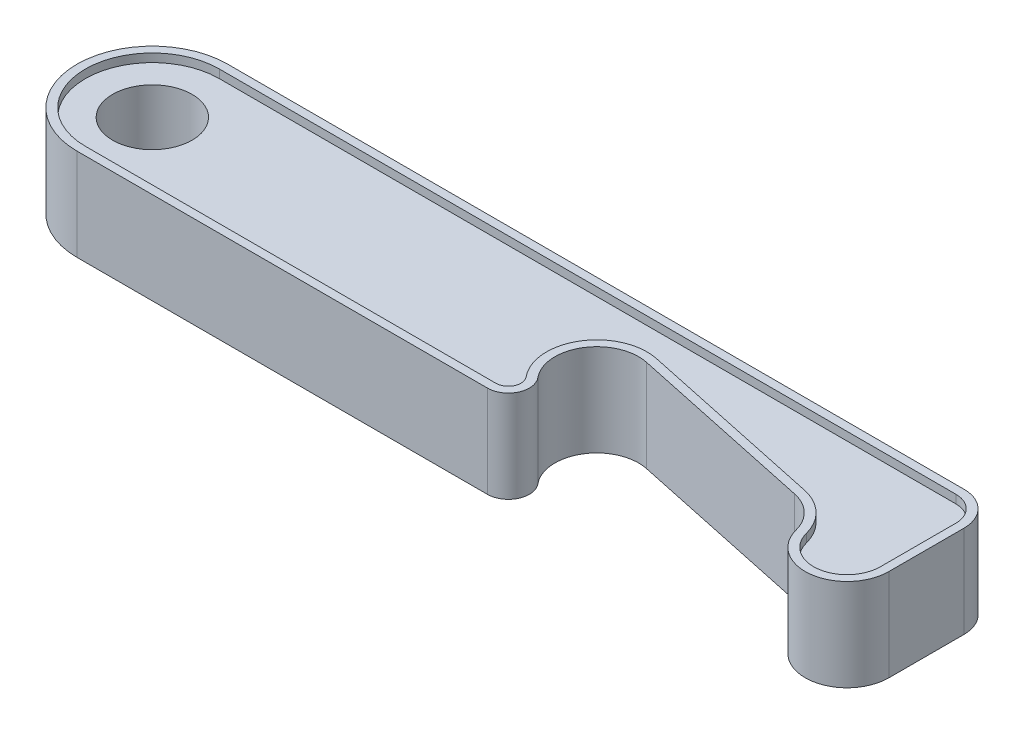
from build123d import *

# Parameters (mm, degrees)
BOSS_EXTRUDE1_DEPTH      = 4.5
BOSS_EXTRUDE1_DEPTH_BACK = 4.5
SKETCH1_R                = 4.75
BOSS_EXTRUDE2_DEPTH      = 5.5
BOSS_EXTRUDE2_DEPTH_BACK = 5.5


with BuildPart() as part:
    # Sketch1 → Boss-Extrude1 (new, two sides: drawn at the far end of the back side and taken through both)
    with BuildSketch(Plane(origin=(0, 0, 0), x_dir=(1, 0, 0), z_dir=(0, 1, 0)).offset(-BOSS_EXTRUDE1_DEPTH_BACK)):
        with BuildLine():
            Line((88, 8), (0, 8))
            ThreePointArc((0, 8), (-8, 0), (0, -8))
            Line((0, -8), (49.040217235, -8))
            ThreePointArc((49.040217235, -8), (50.397559636, -7.138452508), (50.195682115, -5.543495472))
            ThreePointArc((50.195682115, -5.543495472), (49.68486052, 1.389866291), (56.065011779, 4.151408242))
            Line((56.065011779, 4.151408242), (78.565011779, -0.631114396))
            ThreePointArc((78.565011779, -0.631114396), (81.467470443, -2.166630539), (83.127016654, -5))
            ThreePointArc((83.127016654, -5), (87.50401717, -7.968118785), (91, -4))
            Line((91, -4), (91, 5))
            ThreePointArc((91, 5), (90.121320344, 7.121320344), (88, 8))
        make_face()
        Circle(SKETCH1_R, mode=Mode.SUBTRACT)
    extrude(amount=BOSS_EXTRUDE1_DEPTH + BOSS_EXTRUDE1_DEPTH_BACK)

    # Sketch1<3> → Boss-Extrude2 (add, two sides: drawn at the far end of the back side and taken through both)
    with BuildSketch(Plane(origin=(0, 0, 0), x_dir=(1, 0, 0), z_dir=(0, 1, 0)).offset(-BOSS_EXTRUDE2_DEPTH_BACK)):
        with BuildLine():
            Line((88, 9), (0, 9))
            ThreePointArc((0, 9), (-9, 0), (0, -9))
            Line((0, -9), (49.040217235, -9))
            ThreePointArc((49.040217235, -9), (51.302454571, -7.564087513), (50.965992035, -4.905825787))
            ThreePointArc((50.965992035, -4.905825787), (50.540307373, 0.871975682), (55.857100089, 3.173260641))
            Line((55.857100089, 3.173260641), (78.357100089, -1.609261996))
            ThreePointArc((78.357100089, -1.609261996), (80.775815642, -2.888858783), (82.158770817, -5.25))
            ThreePointArc((82.158770817, -5.25), (87.630021462, -8.960148481), (92, -4))
            Line((92, -4), (92, 5))
            ThreePointArc((92, 5), (90.828427125, 7.828427125), (88, 9))
        make_face()
        with BuildLine():
            ThreePointArc((0, -8), (-8, 0), (0, 8))
            Line((0, 8), (88, 8))
            ThreePointArc((88, 8), (90.121320344, 7.121320344), (91, 5))
            Line((91, 5), (91, -4))
            ThreePointArc((91, -4), (87.50401717, -7.968118785), (83.127016654, -5))
            ThreePointArc((83.127016654, -5), (81.467470443, -2.166630539), (78.565011779, -0.631114396))
            Line((78.565011779, -0.631114396), (56.065011779, 4.151408242))
            ThreePointArc((56.065011779, 4.151408242), (49.68486052, 1.389866291), (50.195682115, -5.543495472))
            ThreePointArc((50.195682115, -5.543495472), (50.397559636, -7.138452508), (49.040217235, -8))
            Line((49.040217235, -8), (0, -8))
        make_face(mode=Mode.SUBTRACT)
    extrude(amount=BOSS_EXTRUDE2_DEPTH + BOSS_EXTRUDE2_DEPTH_BACK)


solid = part.part
